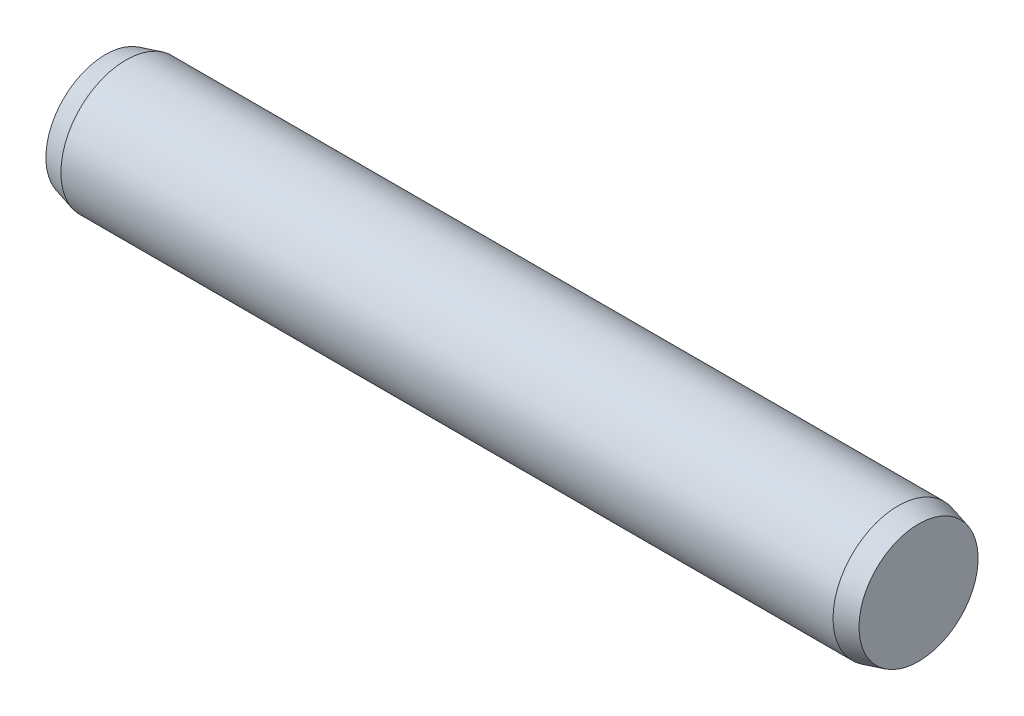
from build123d import *

# Parameters (mm, degrees)
SKETCH_1_W      = 25
SKETCH_1_H      = 2
CHAMFER_1_SIZE  = 0.63
CHAMFER_1_SIZE2 = 0.168807991


with BuildPart() as part:
    # ｽｹｯﾁ1 → 回転1 (revolve)
    with BuildSketch(Plane.XY, mode=Mode.PRIVATE) as revolve_1_sk:
        with Locations((0, 1)):
            Rectangle(SKETCH_1_W, SKETCH_1_H)
    revolve(revolve_1_sk.sketch.rotate(Axis((0, 0, 0), (1, 0, 0)), 90), axis=Axis((0, 0, 0), (1, 0, 0)))

    # 面取り1
    chamfer_1_edges = [part.edges().sort_by_distance(p)[0] for p in [
        (12.5, 0, -2),
        (-12.5, 0, -2),
    ]]
    chamfer_1_side = [part.faces().sort_by_distance(p)[0] for p in [
        (0, 0, -2),
    ]]
    chamfer(chamfer_1_edges, length=CHAMFER_1_SIZE, length2=CHAMFER_1_SIZE2, reference=chamfer_1_side[0])


solid = part.part
